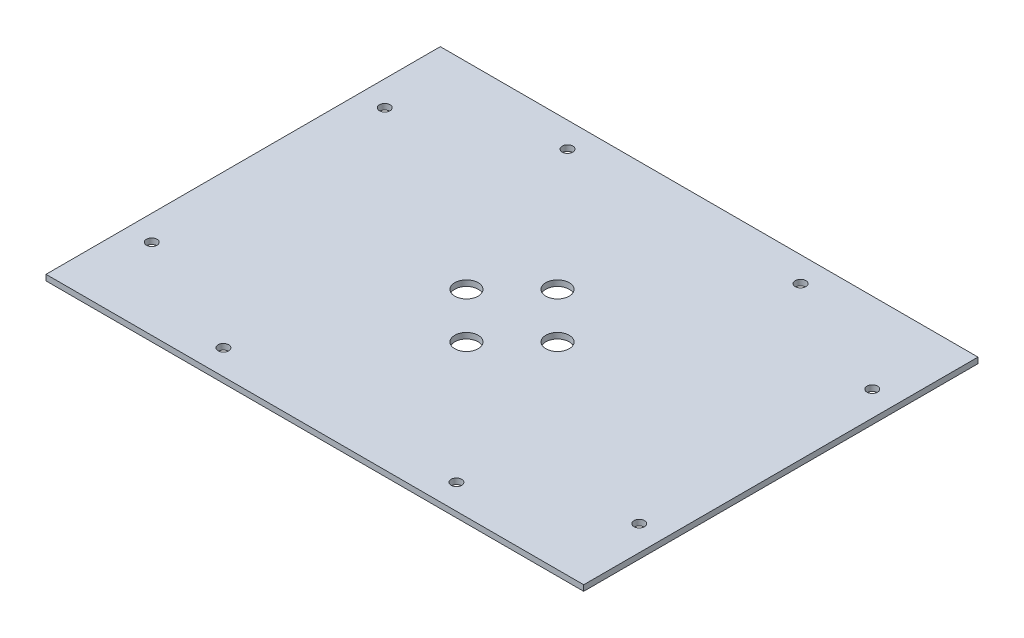
from build123d import *

# Parameters (mm, degrees)
SKETCH1_W           = 150
SKETCH1_H           = 110
SKETCH1_R           = 3.2639
SKETCH1_R_2         = 1.4732
BOSS_EXTRUDE1_DEPTH = 1.6


with BuildPart() as part:
    # Sketch1 → Boss-Extrude1 (new body)
    with BuildSketch(Plane(origin=(0, 0, 0), x_dir=(1, 0, 0), z_dir=(0, 1, 0))):
        Rectangle(SKETCH1_W, SKETCH1_H)
        with Locations(Location((0, 12.7, 0), (0, 0, 270))):
            Circle(SKETCH1_R, mode=Mode.SUBTRACT)
        with Locations(Location((12.7, 0, 0), (0, 0, 270))):
            Circle(SKETCH1_R, mode=Mode.SUBTRACT)
        with Locations(Location((0, -12.7, 0), (0, 0, 270))):
            Circle(SKETCH1_R, mode=Mode.SUBTRACT)
        with Locations(Location((-12.7, 0, 0), (0, 0, 270))):
            Circle(SKETCH1_R, mode=Mode.SUBTRACT)
        with Locations(Location((-32.5, 48, 0), (0, 0, 270))):
            Circle(SKETCH1_R_2, mode=Mode.SUBTRACT)
        with Locations(Location((32.5, 48, 0), (0, 0, 270))):
            Circle(SKETCH1_R_2, mode=Mode.SUBTRACT)
        with Locations(Location((32.5, -48, 0), (0, 0, 270))):
            Circle(SKETCH1_R_2, mode=Mode.SUBTRACT)
        with Locations(Location((-32.5, -48, 0), (0, 0, 270))):
            Circle(SKETCH1_R_2, mode=Mode.SUBTRACT)
        with Locations(Location((-68, 32.5, 0), (0, 0, 270))):
            Circle(SKETCH1_R_2, mode=Mode.SUBTRACT)
        with Locations(Location((68, 32.5, 0), (0, 0, 270))):
            Circle(SKETCH1_R_2, mode=Mode.SUBTRACT)
        with Locations(Location((68, -32.5, 0), (0, 0, 270))):
            Circle(SKETCH1_R_2, mode=Mode.SUBTRACT)
        with Locations(Location((-68, -32.5, 0), (0, 0, 270))):
            Circle(SKETCH1_R_2, mode=Mode.SUBTRACT)
    extrude(amount=BOSS_EXTRUDE1_DEPTH)


solid = part.part
